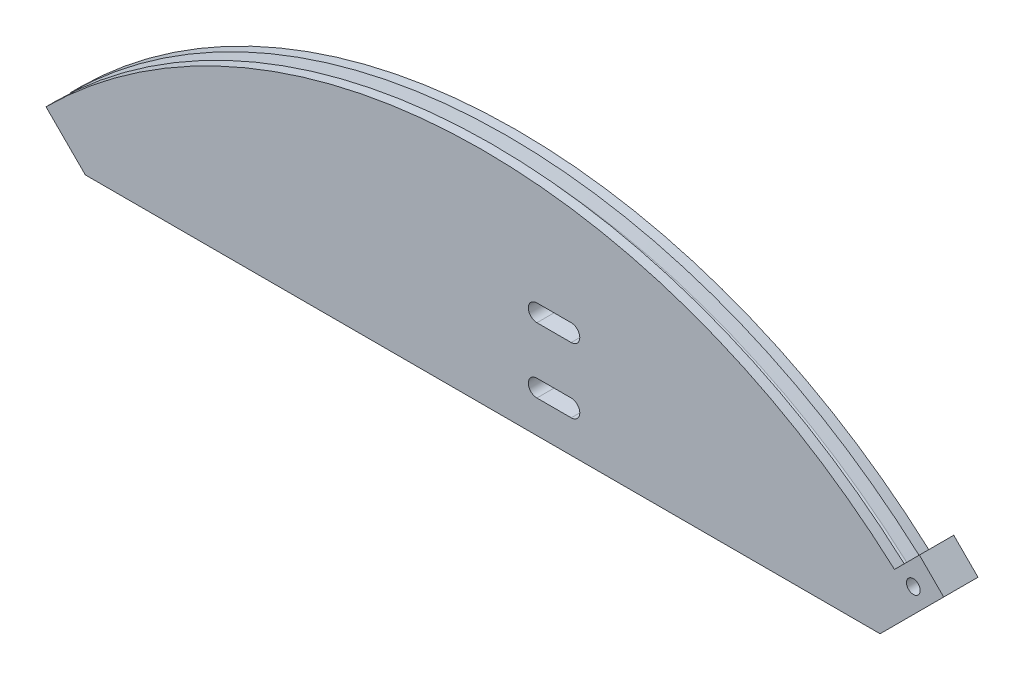
from build123d import *

# Parameters (mm, degrees)
BOSS_EXTRU_1_DEPTH           = 5
BOSS_EXTRU_2_DEPTH           = 5
BOSS_EXTRU_2_DEPTH_BACK      = 5
BOSS_EXTRU_3_DEPTH           = 5
BOSS_EXTRU_3_DEPTH_BACK      = 5
ESQUISSE7_R                  = 2
ENL_V_MAT_EXTRU_4_DEPTH      = 225.666419389
ENL_V_MAT_EXTRU_4_DEPTH_BACK = 225.666419389
ENL_V_MAT_EXTRU_6_DEPTH      = 225.666419389
ENL_V_MAT_EXTRU_6_DEPTH_BACK = 225.666419389
CHANFREIN1_SIZE              = 0.5


with BuildPart() as part:
    # Esquisse1 → Boss.-Extru.1 (new body)
    with BuildSketch(Plane.XY):
        with BuildLine():
            Line((-120.208152802, 115.814760073), (120.208152802, 115.814760073))
            Line((120.208152802, 115.814760073), (120.208152802, 120.208152802))
            ThreePointArc((120.208152802, 120.208152802), (0, 170), (-120.208152802, 120.208152802))
            Line((-120.208152802, 120.208152802), (-120.208152802, 115.814760073))
        make_face()
    extrude(amount=BOSS_EXTRU_1_DEPTH)

    # Esquisse2 → Boss.-Extru.2 (add, two sides: drawn at the far end of the back side and taken through both)
    with BuildSketch(Plane(origin=(0, 0, 0), x_dir=(-1, 0, 0), z_dir=(0, 0, -1)).offset(-BOSS_EXTRU_2_DEPTH_BACK)):
        with BuildLine():
            Line((127.279220614, 127.279220614), (120.208152802, 120.208152802))
            ThreePointArc((120.208152802, 120.208152802), (0, 170), (-120.208152802, 120.208152802))
            Line((-120.208152802, 120.208152802), (-127.279220614, 127.279220614))
            ThreePointArc((-127.279220614, 127.279220614), (0, 180), (127.279220614, 127.279220614))
        make_face()
    extrude(amount=BOSS_EXTRU_2_DEPTH + BOSS_EXTRU_2_DEPTH_BACK)

    # Enlèvement de matière-Balayage1: sweep along a path in Esquisse3
    with BuildLine(Plane(origin=(0, 0, 0), x_dir=(-1, 0, 0), z_dir=(0, 0, -1))) as enl_vement_de_mati_re_balayage1_path:
        ThreePointArc((126.572113832, 126.572113832), (0, 179), (-126.572113832, 126.572113832))
    # Esquisse5 → Enlèvement de matière-Balayage1 (sweep, cut)
    with BuildSketch(Plane(origin=(0, 0, 0), x_dir=(0, 0, -1), z_dir=(0.7071067811865468, -0.7071067811865483, 0))):
        with BuildLine():
            Line((-0.939692621, 176.657979857), (-2.156088475, 180))
            Line((-2.156088475, 180), (2.156088475, 180))
            Line((2.156088475, 180), (0.939692621, 176.657979857))
            ThreePointArc((0.939692621, 176.657979857), (0, 176), (-0.939692621, 176.657979857))
        make_face()
    sweep(path=enl_vement_de_mati_re_balayage1_path.line, mode=Mode.SUBTRACT)

    # Esquisse7 → Boss.-Extru.3 (add, two sides: drawn at the far end of the back side and taken through both)
    with BuildSketch(Plane(origin=(0, 0, 0), x_dir=(-1, 0, 0), z_dir=(0, 0, -1)).offset(-BOSS_EXTRU_3_DEPTH_BACK)):
        Polygon((-123.743686708, 123.743686708), (-134.350288425, 134.350288425), (-127.279220614, 141.421356237), (-116.672618896, 130.81475452), align=None)
        with Locations((-125.511453661, 132.582521472)):
            Circle(ESQUISSE7_R, mode=Mode.SUBTRACT)
    extrude(amount=BOSS_EXTRU_3_DEPTH + BOSS_EXTRU_3_DEPTH_BACK)

    # Esquisse8 → Enlèv. mat.-Extru.4 (cut, two sides: drawn at the far end of the back side and taken through both)
    with BuildSketch(Plane(origin=(0, 0, 0), x_dir=(-1, 0, 0), z_dir=(0, 0, -1)).offset(-ENL_V_MAT_EXTRU_4_DEPTH_BACK)):
        Polygon((-120.208152802, 120.208152802), (-104.630387374, 104.630387374), (-145.023097607, 109.535343621), (-125.124551125, 125.124551125), align=None)
        Polygon((127.279220614, 127.279220614), (100.741517302, 100.741517302), (140.507843055, 93.246561367), align=None)
    extrude(amount=ENL_V_MAT_EXTRU_4_DEPTH + ENL_V_MAT_EXTRU_4_DEPTH_BACK, mode=Mode.SUBTRACT)

    # Esquisse10 → Enlèv. mat.-Extru.6 (cut, two sides: drawn at the far end of the back side and taken through both)
    with BuildSketch(Plane(origin=(0, 0, 0), x_dir=(-1, 0, 0), z_dir=(0, 0, -1)).offset(-ENL_V_MAT_EXTRU_6_DEPTH_BACK)):
        with BuildLine():
            Line((-25.791169082, 149.314760073), (-15.791169082, 149.314760073))
            ThreePointArc((-15.791169082, 149.314760073), (-13.291169082, 146.814760073), (-15.791169082, 144.314760073))
            Line((-15.791169082, 144.314760073), (-25.791169082, 144.314760073))
            ThreePointArc((-25.791169082, 144.314760073), (-28.291169082, 146.814760073), (-25.791169082, 149.314760073))
        make_face()
        with BuildLine():
            Line((-25.791169082, 130.314760073), (-15.791169082, 130.314760073))
            ThreePointArc((-15.791169082, 130.314760073), (-13.291169082, 127.814760073), (-15.791169082, 125.314760073))
            Line((-15.791169082, 125.314760073), (-25.791169082, 125.314760073))
            ThreePointArc((-25.791169082, 125.314760073), (-28.291169082, 127.814760073), (-25.791169082, 130.314760073))
        make_face()
    extrude(amount=ENL_V_MAT_EXTRU_6_DEPTH + ENL_V_MAT_EXTRU_6_DEPTH_BACK, mode=Mode.SUBTRACT)

    # Chanfrein1
    chanfrein1_edges = [part.edges().sort_by_distance(p)[0] for p in [
        (0, 115.814760073, 0),
    ]]
    chamfer(chanfrein1_edges, length=CHANFREIN1_SIZE)


solid = part.part
